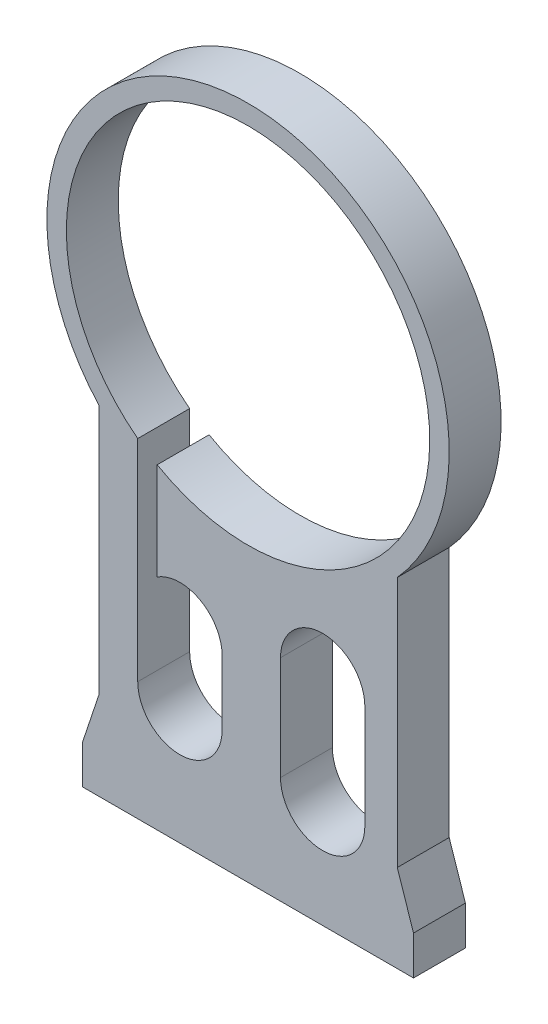
from build123d import *

# Parameters (mm, degrees)
DODANIE_WYCI_GNI_CIE1_DEPTH = 4


with BuildPart() as part:
    # Szkic1 → Dodanie-wyciągnięcie1 (new body)
    with BuildSketch(Plane.XY):
        with BuildLine():
            Line((12.75, 0), (-12.75, 0))
            Line((-12.75, 0), (-12.75, 3))
            Line((-12.75, 3), (-11.5, 6.75))
            Line((-11.5, 6.75), (-11.5, 26.107695155))
            ThreePointArc((-11.5, 26.107695155), (0, 52), (11.5, 26.107695155))
            Line((11.5, 26.107695155), (11.5, 6.75))
            Line((11.5, 6.75), (12.75, 3))
            Line((12.75, 3), (12.75, 0))
        make_face()
        with BuildLine():
            Line((-2, 14.15), (-2, 9.15))
            ThreePointArc((-2, 9.15), (-5.25, 5.9), (-8.5, 9.15))
            Line((-8.5, 9.15), (-8.5, 14.15))
            Line((-8.5, 14.15), (-8.5, 25.375702269))
            ThreePointArc((-8.5, 25.375702269), (7.766114148, 48.148496514), (-7, 24.375644347))
            Line((-7, 24.375644347), (-7, 16.888612788))
            ThreePointArc((-7, 16.888612788), (-3.6887505, 17.000438563), (-2, 14.15))
        make_face(mode=Mode.SUBTRACT)
        with BuildLine():
            Line((9, 16.25), (9, 8.25))
            ThreePointArc((9, 8.25), (5.75, 5), (2.5, 8.25))
            Line((2.5, 8.25), (2.5, 16.25))
            ThreePointArc((2.5, 16.25), (5.75, 19.5), (9, 16.25))
        make_face(mode=Mode.SUBTRACT)
    extrude(amount=DODANIE_WYCI_GNI_CIE1_DEPTH)


solid = part.part
